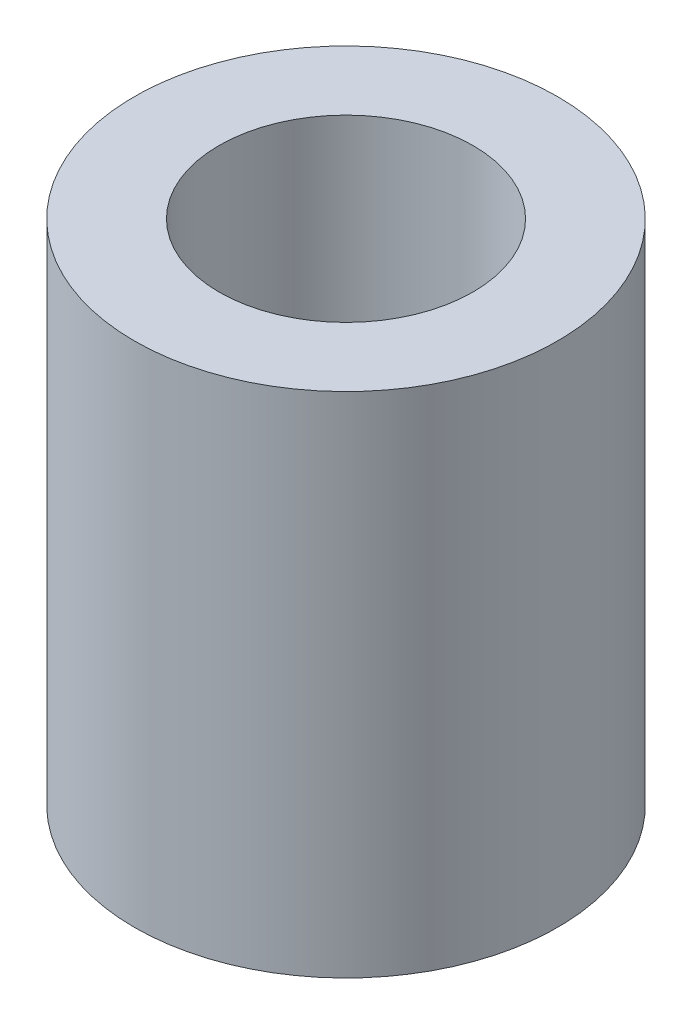
from build123d import *

# Parameters (mm, degrees)
SKETCH1_R           = 5
SKETCH1_R_2         = 3
BOSS_EXTRUDE1_DEPTH = 12


with BuildPart() as part:
    # Sketch1 → Boss-Extrude1 (new body)
    with BuildSketch(Plane(origin=(0, 0, 0), x_dir=(1, 0, 0), z_dir=(0, 1, 0))):
        with Locations(Location((0, 0, 0), (0, 0, 270))):
            Circle(SKETCH1_R)
        with Locations(Location((0, 0, 0), (0, 0, 270))):
            Circle(SKETCH1_R_2, mode=Mode.SUBTRACT)
    extrude(amount=BOSS_EXTRUDE1_DEPTH)


solid = part.part
